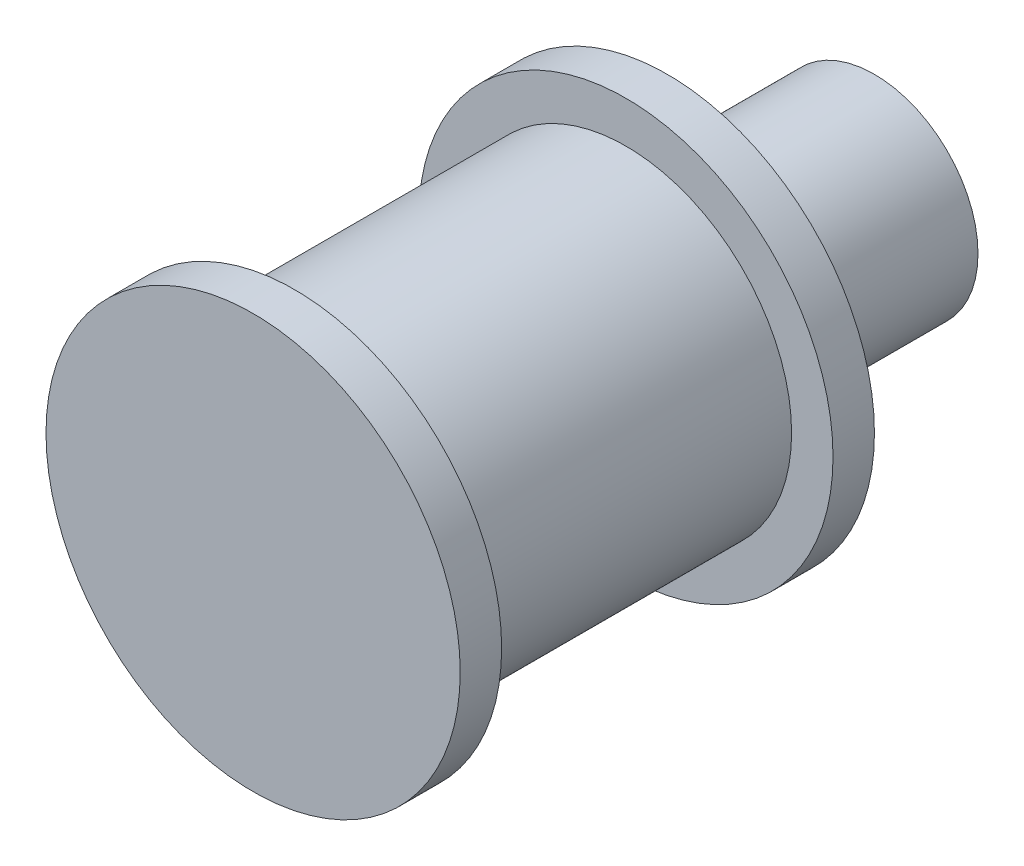
from build123d import *

# Parameters (mm, degrees)
SKETCH1_R           = 2.5
BOSS_EXTRUDE1_DEPTH = 5
SKETCH2_R           = 5
BOSS_EXTRUDE2_DEPTH = 1
SKETCH3_R           = 4
BOSS_EXTRUDE3_DEPTH = 8
SKETCH4_R           = 5
BOSS_EXTRUDE4_DEPTH = 1


with BuildPart() as part:
    # Sketch1 → Boss-Extrude1 (new body)
    with BuildSketch(Plane.XY):
        Circle(SKETCH1_R)
    extrude(amount=BOSS_EXTRUDE1_DEPTH)

    # Sketch2 → Boss-Extrude2 (add)
    with BuildSketch(Plane.XY.offset(5)):
        Circle(SKETCH2_R)
    extrude(amount=BOSS_EXTRUDE2_DEPTH)

    # Sketch3 → Boss-Extrude3 (add)
    with BuildSketch(Plane.XY.offset(6)):
        Circle(SKETCH3_R)
    extrude(amount=BOSS_EXTRUDE3_DEPTH)

    # Sketch4 → Boss-Extrude4 (add)
    with BuildSketch(Plane.XY.offset(14)):
        Circle(SKETCH4_R)
    extrude(amount=BOSS_EXTRUDE4_DEPTH)


solid = part.part
